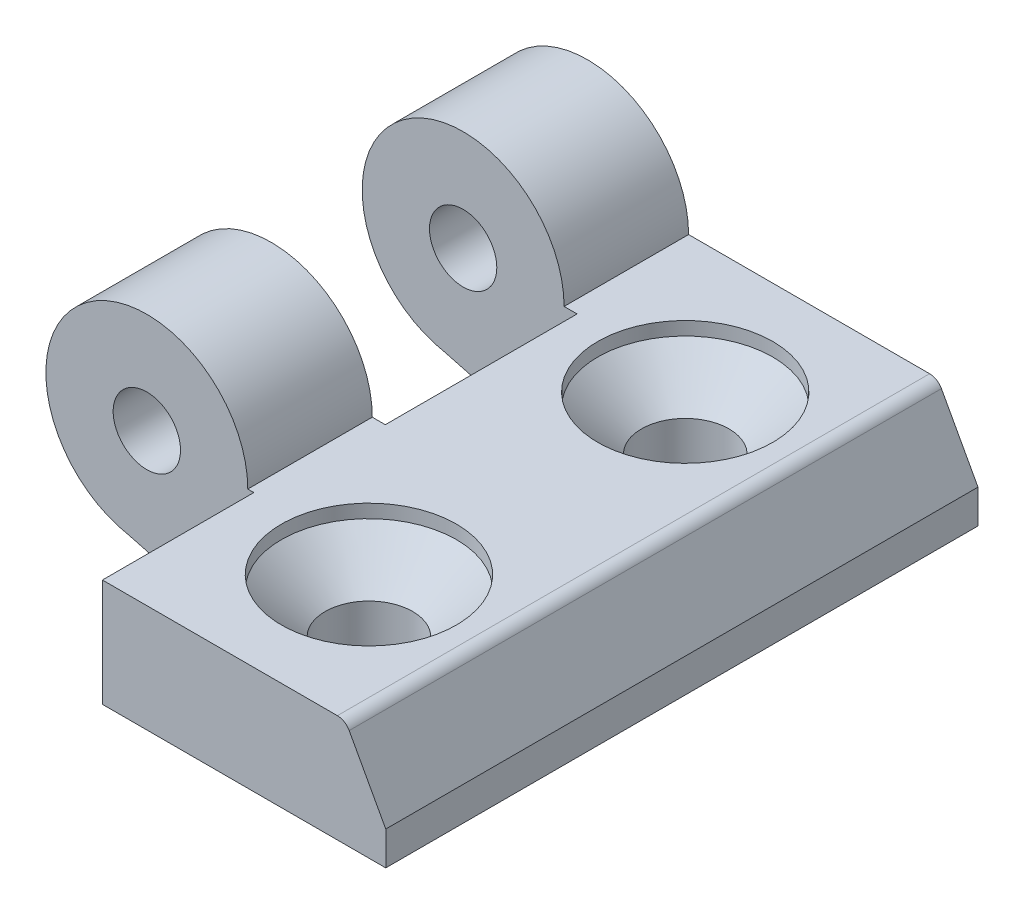
from build123d import *

# Parameters (mm, degrees)
EXTRUDE_1_DEPTH          = 22
PATTERN_LINEAR_1_COUNT   = 2
PATTERN_LINEAR_1_PITCH   = 23.5
CUT_EXTRUDE_1_DEPTH      = 38.269290307
CUT_EXTRUDE_1_DEPTH_BACK = 38.269290307
SKETCH_4_W               = 15.894607506
SKETCH_4_H               = 11.25
SKETCH_4_W_2             = 16.409425433
SKETCH_4_H_2             = 14.25
SKETCH_5_R               = 2.5
CUT_EXTRUDE_2_DEPTH      = 45.469793118


with BuildPart() as part:
    # 草图1 → 凸台-拉伸1 (new, symmetric)
    with BuildSketch(Plane.XY):
        with BuildLine():
            Line((29, -5.5), (29, -8))
            Line((29, -8), (1, -8))
            Line((1, -8), (-1.370141735, -7.373785434))
            ThreePointArc((-1.370141735, -7.373785434), (-4.794472702, 5.767411162), (7.5, 0))
            Line((7.5, 0), (25.406366901, 0))
            ThreePointArc((25.406366901, 0), (25.916831332, -0.140101131), (26.284262474, -0.521147869))
            Line((26.284262474, -0.521147869), (29, -5.5))
        make_face()
    extrude(amount=EXTRUDE_1_DEPTH, both=True)

    # 草图3 → 切除-旋转1 (revolve, cut)
    with BuildSketch(Plane.XY.offset(11.75), mode=Mode.PRIVATE) as cut_revolve_1_sk:
        Polygon((24, 0), (17.5, 0), (17.5, -8), (20.75, -8), (20.75, -4), (24, -1), align=None)
    cut_revolve_1 = revolve(cut_revolve_1_sk.sketch.rotate(Axis((17.5, -8, 11.75), (0, 1, 0)), 90), axis=Axis((17.5, -8, 11.75), (0, 1, 0)), mode=Mode.SUBTRACT)

    # 阵列(线性)1: 切除-旋转1 ×2
    with Locations(*[(0, 0, -i * PATTERN_LINEAR_1_PITCH) for i in range(1, PATTERN_LINEAR_1_COUNT)]):
        add(cut_revolve_1, mode=Mode.SUBTRACT)

    # 草图4 → 切除-拉伸1 (cut, two sides: drawn at the far end of the back side and taken through both)
    with BuildSketch(Plane(origin=(0, 0, 0), x_dir=(1, 0, 0), z_dir=(0, 1, 0)).offset(-CUT_EXTRUDE_1_DEPTH_BACK)):
        with Locations((0.004095995, -16.375)):
            Rectangle(SKETCH_4_W, SKETCH_4_H)
        with Locations((0.261504959, 5.625)):
            Rectangle(SKETCH_4_W_2, SKETCH_4_H_2)
    extrude(amount=CUT_EXTRUDE_1_DEPTH + CUT_EXTRUDE_1_DEPTH_BACK, mode=Mode.SUBTRACT)

    # 草图5 → 切除-拉伸2 (cut, through all)
    with BuildSketch(Plane.XY.offset(10.75)):
        Circle(SKETCH_5_R)
    extrude(amount=-CUT_EXTRUDE_2_DEPTH, mode=Mode.SUBTRACT)


solid = part.part
